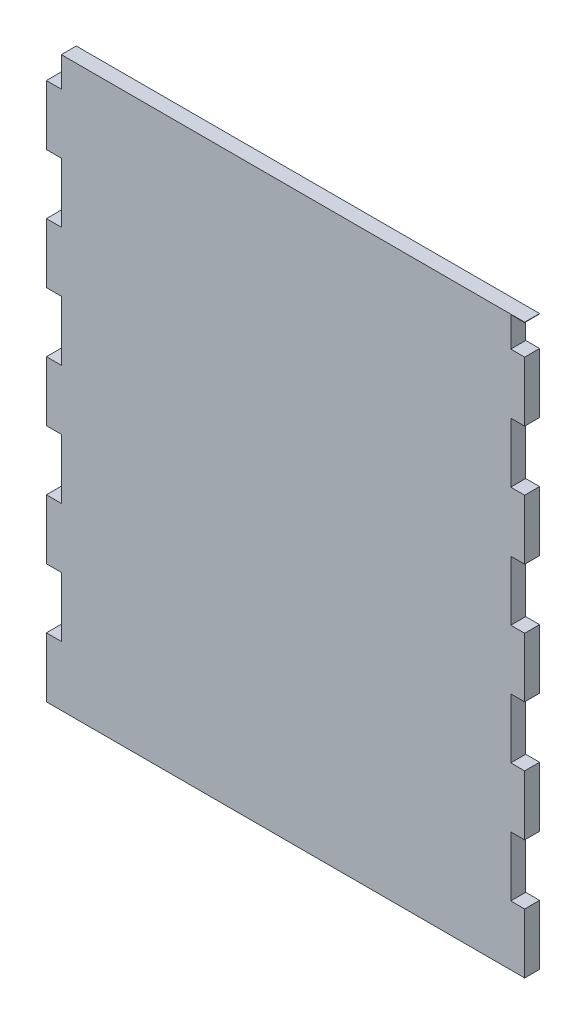
from build123d import *

# Parameters (mm, degrees)
SKETCH1_W           = 203.2
SKETCH1_H           = 241.3
BOSS_EXTRUDE1_DEPTH = 6.35
SKETCH2_W           = 6.35
SKETCH2_H           = 25.4
SKETCH2_H_2         = 12.7
CUT_EXTRUDE2_DEPTH  = 7.62


with BuildPart() as part:
    # Sketch1 → Boss-Extrude1 (new body)
    with BuildSketch(Plane.XY):
        with Locations((-101.068226601, -2.674507389)):
            Rectangle(SKETCH1_W, SKETCH1_H)
    extrude(amount=BOSS_EXTRUDE1_DEPTH)

    # Sketch2 → Cut-Extrude2 (cut)
    with BuildSketch(Plane.XY.offset(6.35)):
        with Locations((-199.493226601, -85.224507389)):
            Rectangle(SKETCH2_W, SKETCH2_H)
        with Locations((-199.493226601, -34.424507389)):
            Rectangle(SKETCH2_W, SKETCH2_H)
        with Locations((-199.493226601, 16.375492611)):
            Rectangle(SKETCH2_W, SKETCH2_H)
        with Locations((-199.493226601, 67.175492611)):
            Rectangle(SKETCH2_W, SKETCH2_H)
        with Locations((-199.493226601, 111.625492611)):
            Rectangle(SKETCH2_W, SKETCH2_H_2)
        with Locations((-2.202282379, -85.224507389)):
            Rectangle(SKETCH2_W, SKETCH2_H)
        with Locations((-2.202282379, -34.424507389)):
            Rectangle(SKETCH2_W, SKETCH2_H)
        with Locations((-2.202282379, 16.208154802)):
            Rectangle(SKETCH2_W, SKETCH2_H)
        with Locations((-2.202282379, 67.008154802)):
            Rectangle(SKETCH2_W, SKETCH2_H)
        with Locations((-2.202282379, 111.458154802)):
            Rectangle(SKETCH2_W, SKETCH2_H_2)
    extrude(amount=-CUT_EXTRUDE2_DEPTH, mode=Mode.SUBTRACT)


solid = part.part
